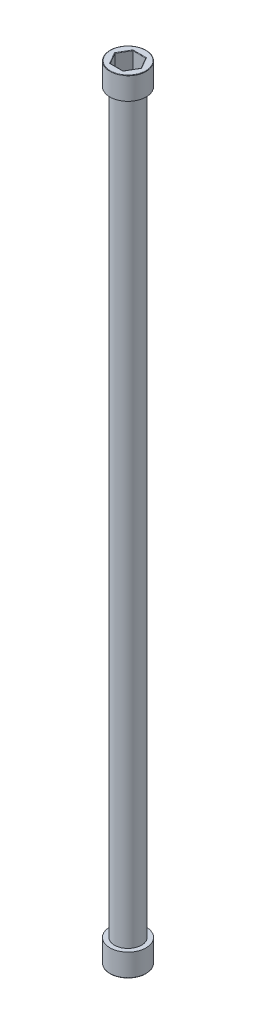
from build123d import *

# Parameters (mm, degrees)
SKETCH2_R            = 3
BOSS_EXTRUDE1_DEPTH  = 81.5
SKETCH4_R            = 4
BOSS_EXTRUDE2_DEPTH  = 5
CUT_EXTRUDE1_DEPTH   = 4
FILLET1_R            = 0.1
FILLET1_OF_MIRROR1_R = 0.1


with BuildPart() as part:
    # Sketch2 → Boss-Extrude1 (new, symmetric)
    with BuildSketch(Plane(origin=(0, 0, 0), x_dir=(1, 0, 0), z_dir=(0, 1, 0))):
        with Locations(Location((0, 0, 0), (0, 0, 270))):
            Circle(SKETCH2_R)
    extrude(amount=BOSS_EXTRUDE1_DEPTH, both=True)

    # Sketch4 → Boss-Extrude2 (add)
    with BuildSketch(Plane(origin=(0, 81.5, 0), x_dir=(1, 0, 0), z_dir=(0, 1, 0))):
        with Locations(Location((0, 0, 0), (0, 0, 270))):
            Circle(SKETCH4_R)
    boss_extrude2 = extrude(amount=BOSS_EXTRUDE2_DEPTH)

    # Sketch5 → Cut-Extrude1 (cut)
    with BuildSketch(Plane(origin=(0, 86.5, 0), x_dir=(1, 0, 0), z_dir=(0, 1, 0))):
        Polygon((1.443375673, -2.5), (2.886751346, 0), (1.443375673, 2.5), (-1.443375673, 2.5), (-2.886751346, 0), (-1.443375673, -2.5), align=None)
    cut_extrude1 = extrude(amount=-CUT_EXTRUDE1_DEPTH, mode=Mode.SUBTRACT)

    # Fillet1
    fillet1_edges = [part.edges().sort_by_distance(p)[0] for p in [
        (0, 82.5, 2.5),
        (-2.165063509, 82.5, 1.25),
        (-2.165063509, 82.5, -1.25),
        (0, 82.5, -2.5),
        (2.165063509, 82.5, -1.25),
        (2.165063509, 82.5, 1.25),
        (0, 86.5, 2.5),
        (2.165063509, 86.5, 1.25),
        (2.165063509, 86.5, -1.25),
        (0, 86.5, -2.5),
        (-2.165063509, 86.5, -1.25),
        (-2.165063509, 86.5, 1.25),
        (0, 86.5, -4),
    ]]
    fillet(fillet1_edges, radius=FILLET1_R)

    # Mirror1: Boss-Extrude2, Cut-Extrude1 across plane
    add(boss_extrude2.mirror(Plane.ZX))
    add(cut_extrude1.mirror(Plane.ZX), mode=Mode.SUBTRACT)

    # Fillet1 of Mirror1
    fillet1_of_mirror1_edges = [part.edges().sort_by_distance(p)[0] for p in [
        (0, -82.5, 2.5),
        (-2.165063509, -82.5, 1.25),
        (-2.165063509, -82.5, -1.25),
        (0, -82.5, -2.5),
        (2.165063509, -82.5, -1.25),
        (2.165063509, -82.5, 1.25),
        (0, -86.5, 2.5),
        (2.165063509, -86.5, 1.25),
        (2.165063509, -86.5, -1.25),
        (0, -86.5, -2.5),
        (-2.165063509, -86.5, -1.25),
        (-2.165063509, -86.5, 1.25),
        (0, -86.5, -4),
    ]]
    fillet(fillet1_of_mirror1_edges, radius=FILLET1_OF_MIRROR1_R)


solid = part.part
